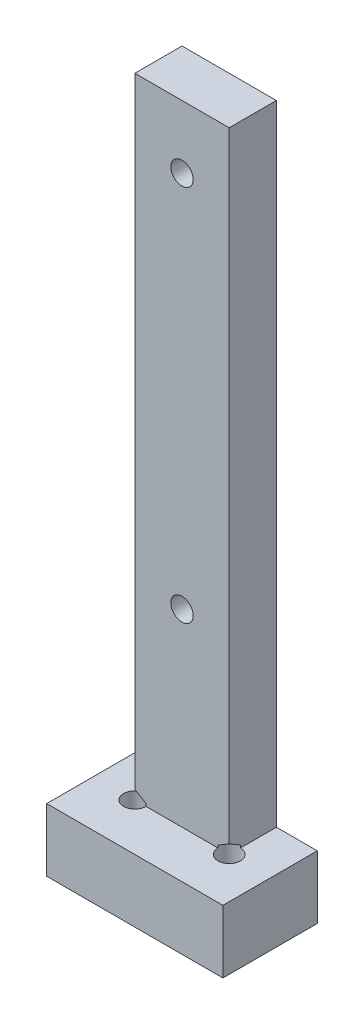
from build123d import *

# Parameters (mm, degrees)
SKETCH1_W                 = 17.78
SKETCH1_H                 = 9.525
BOSS_EXTRUDE1_DEPTH       = 69.85
SKETCH2_W                 = 17.78
SKETCH2_H                 = 4.7625
CUT_EXTRUDE1_DEPTH        = 63.5
F_4_40_TAPPED_HOLE1_D     = 2.2606
F_4_40_TAPPED_HOLE1_DEPTH = 6.604
F_4_40_TAPPED_HOLE1_TIP   = 0.679152758
F_4_40_TAPPED_HOLE2_D     = 2.2606
F_4_40_TAPPED_HOLE2_DEPTH = 8.89
F_4_40_TAPPED_HOLE2_TIP   = 0.679152758
SKETCH9_W                 = 4.1275
SKETCH9_H                 = 63.5
CUT_EXTRUDE2_DEPTH        = 71.574329655


with BuildPart() as part:
    # Sketch1 → Boss-Extrude1 (new body)
    with BuildSketch(Plane(origin=(0, 0, 0), x_dir=(1, 0, 0), z_dir=(0, 1, 0))):
        Rectangle(SKETCH1_W, SKETCH1_H)
    extrude(amount=BOSS_EXTRUDE1_DEPTH)

    # Sketch2 → Cut-Extrude1 (cut)
    with BuildSketch(Plane(origin=(0, 69.85, 0), x_dir=(1, 0, 0), z_dir=(0, 1, 0))):
        with Locations((0, -2.38125)):
            Rectangle(SKETCH2_W, SKETCH2_H)
    extrude(amount=-CUT_EXTRUDE1_DEPTH, mode=Mode.SUBTRACT)

    # #4-40 Tapped Hole1
    with Locations(Plane(origin=(0, 0, 0), x_dir=(-1, 0, 0), z_dir=(0, -1, 0))):
        with Locations((-4.7625, 0), (4.7625, 0)):
            Hole(F_4_40_TAPPED_HOLE1_D / 2, depth=F_4_40_TAPPED_HOLE1_DEPTH)
            with Locations((0, 0, -(F_4_40_TAPPED_HOLE1_DEPTH + F_4_40_TAPPED_HOLE1_TIP / 2))):  # 118° drill point
                Cone(0, F_4_40_TAPPED_HOLE1_D / 2, F_4_40_TAPPED_HOLE1_TIP, mode=Mode.SUBTRACT)

    # #4-40 Tapped Hole2
    with Locations(Plane.XY):
        with Locations((0, 25.4), (0, 63.5)):
            Hole(F_4_40_TAPPED_HOLE2_D / 2, depth=F_4_40_TAPPED_HOLE2_DEPTH)
            with Locations((0, 0, -(F_4_40_TAPPED_HOLE2_DEPTH + F_4_40_TAPPED_HOLE2_TIP / 2))):  # 118° drill point
                Cone(0, F_4_40_TAPPED_HOLE2_D / 2, F_4_40_TAPPED_HOLE2_TIP, mode=Mode.SUBTRACT)

    # Sketch9 → Cut-Extrude2 (cut, through all)
    with BuildSketch(Plane.XY):
        with Locations((-6.82625, 38.1)):
            Rectangle(SKETCH9_W, SKETCH9_H)
        with Locations((6.82625, 38.1)):
            Rectangle(SKETCH9_W, SKETCH9_H)
    extrude(amount=-CUT_EXTRUDE2_DEPTH, mode=Mode.SUBTRACT)


solid = part.part
